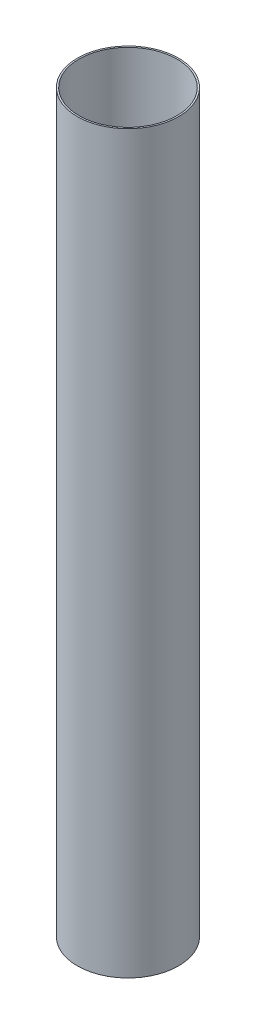
from build123d import *

# Parameters (mm, degrees)
SKETCH1_R           = 78.5
SKETCH1_R_2         = 76
BOSS_EXTRUDE1_DEPTH = 1140


with BuildPart() as part:
    # Sketch1 → Boss-Extrude1 (new body)
    with BuildSketch(Plane(origin=(0, 0, 0), x_dir=(1, 0, 0), z_dir=(0, 1, 0))):
        with Locations(Location((0, 0, 0), (0, 0, 270))):
            Circle(SKETCH1_R)
        with Locations(Location((0, 0, 0), (0, 0, 270))):
            Circle(SKETCH1_R_2, mode=Mode.SUBTRACT)
    extrude(amount=BOSS_EXTRUDE1_DEPTH)


solid = part.part
